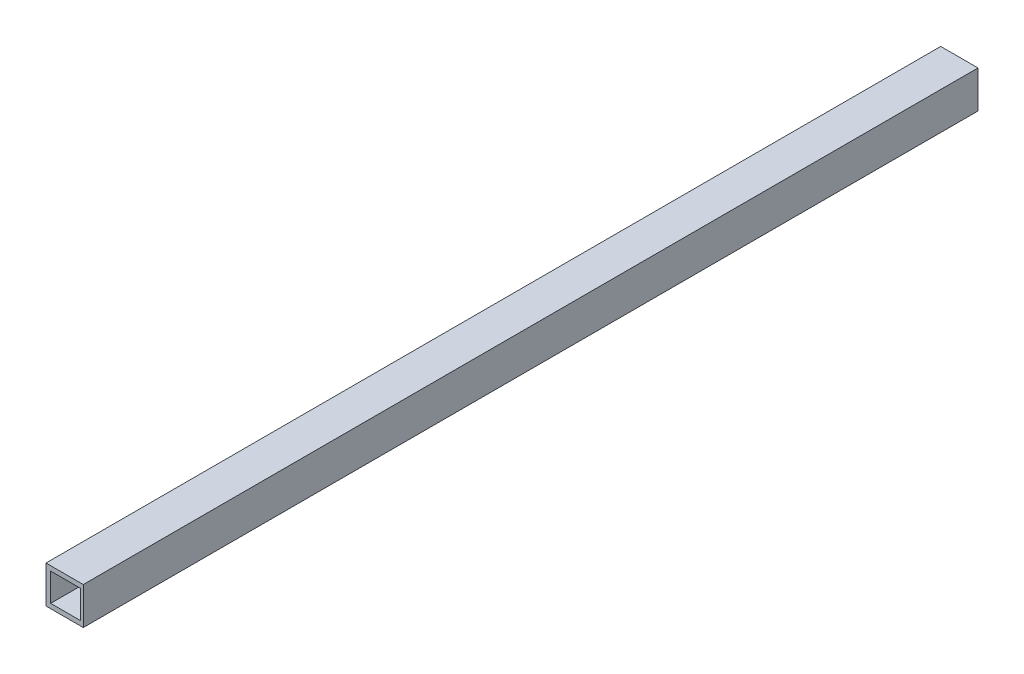
from build123d import *

# Parameters (mm, degrees)
SKETCH1_W           = 25.4
SKETCH1_H           = 25.4
BOSS_EXTRUDE2_DEPTH = 609.6
SKETCH2_W           = 20.302766191
SKETCH2_H           = 19.05
CUT_EXTRUDE1_DEPTH  = 611.657416233


with BuildPart() as part:
    # Sketch1 → Boss-Extrude2 (new body)
    with BuildSketch(Plane.XY):
        with Locations((12.7, 12.7)):
            Rectangle(SKETCH1_W, SKETCH1_H)
    extrude(amount=BOSS_EXTRUDE2_DEPTH)

    # Sketch2 → Cut-Extrude1 (cut, through all)
    with BuildSketch(Plane(origin=(0, 0, 0), x_dir=(-1, 0, 0), z_dir=(0, 0, -1))):
        with Locations((-13.326383096, 12.7)):
            Rectangle(SKETCH2_W, SKETCH2_H)
    extrude(amount=-CUT_EXTRUDE1_DEPTH, mode=Mode.SUBTRACT)


solid = part.part
